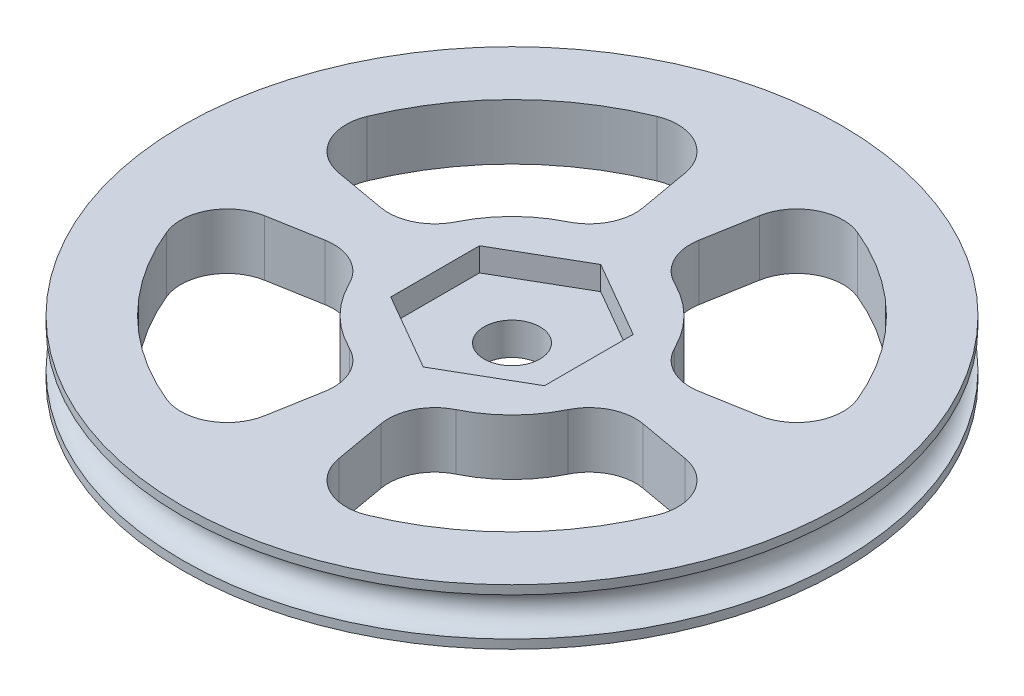
from build123d import *

# Parameters (mm, degrees)
CUT_EXTRUDE1_DEPTH = 41.519966486
CIRPATTERN1_COUNT  = 4
CUT_EXTRUDE2_DEPTH = 2.032
SKETCH7_R          = 2.413
CUT_EXTRUDE3_DEPTH = 41.519966486


with BuildPart() as part:
    # Sketch1 → Revolve1 (revolve)
    with BuildSketch(Plane(origin=(0, 0, 0), x_dir=(0, 0, -1), z_dir=(1, 0, 0))):
        with BuildLine():
            Line((0, -1.651), (0, 1.651))
            Line((0, 1.651), (0, 2.413))
            Line((0, 2.413), (-28.448, 2.413))
            Line((-28.448, 2.413), (-28.448, 1.651))
            ThreePointArc((-28.448, 1.651), (-26.797, 0), (-28.448, -1.651))
            Line((-28.448, -1.651), (-28.448, -2.413))
            Line((-28.448, -2.413), (0, -2.413))
            Line((0, -2.413), (0, -1.651))
        make_face()
    revolve(axis=Axis((0, -1.651, 0), (0, 1, 0)))

    # Sketch4 → Cut-Extrude1 (cut, through all)
    with BuildSketch(Plane(origin=(0, 2.413, 0), x_dir=(1, 0, 0), z_dir=(0, 1, 0))):
        with BuildLine():
            Line((-18.150933962, -3.200499383), (-13.725620051, -2.420197142))
            ThreePointArc((-13.725620051, -2.420197142), (-11.215481947, -2.795189817), (-9.436261178, -4.605103146))
            ThreePointArc((-9.436261178, -4.605103146), (-7.424621202, -7.424621202), (-4.605103146, -9.436261178))
            ThreePointArc((-4.605103146, -9.436261178), (-2.795189817, -11.215481947), (-2.420197142, -13.725620051))
            Line((-2.420197142, -13.725620051), (-3.200499383, -18.150933962))
            ThreePointArc((-3.200499383, -18.150933962), (-5.207970247, -20.958954952), (-8.653989227, -21.158640563))
            ThreePointArc((-8.653989227, -21.158640563), (-16.164461018, -16.164461018), (-21.158640563, -8.653989227))
            ThreePointArc((-21.158640563, -8.653989227), (-20.958954952, -5.207970247), (-18.150933962, -3.200499383))
        make_face()
    cut_extrude1 = extrude(amount=-CUT_EXTRUDE1_DEPTH, mode=Mode.SUBTRACT)

    # CirPattern1: Cut-Extrude1 ×4 about axis
    cirpattern1_axis = Axis((0, 2.413, 0), (0, -1, 0))
    for i in range(1, CIRPATTERN1_COUNT):
        add(cut_extrude1.rotate(cirpattern1_axis, i * 360 / CIRPATTERN1_COUNT), mode=Mode.SUBTRACT)

    # Sketch6 → Cut-Extrude2 (cut)
    with BuildSketch(Plane(origin=(0, 2.413, 0), x_dir=(1, 0, 0), z_dir=(0, 1, 0))):
        Polygon((0, 7.661438072), (-6.635, 3.830719036), (-6.635, -3.830719036), (0, -7.661438072), (6.635, -3.830719036), (6.635, 3.830719036), align=None)
    extrude(amount=-CUT_EXTRUDE2_DEPTH, mode=Mode.SUBTRACT)

    # Sketch7 → Cut-Extrude3 (cut, through all)
    with BuildSketch(Plane(origin=(0, 2.413, 0), x_dir=(1, 0, 0), z_dir=(0, 1, 0))):
        Circle(SKETCH7_R)
    extrude(amount=-CUT_EXTRUDE3_DEPTH, mode=Mode.SUBTRACT)


solid = part.part
